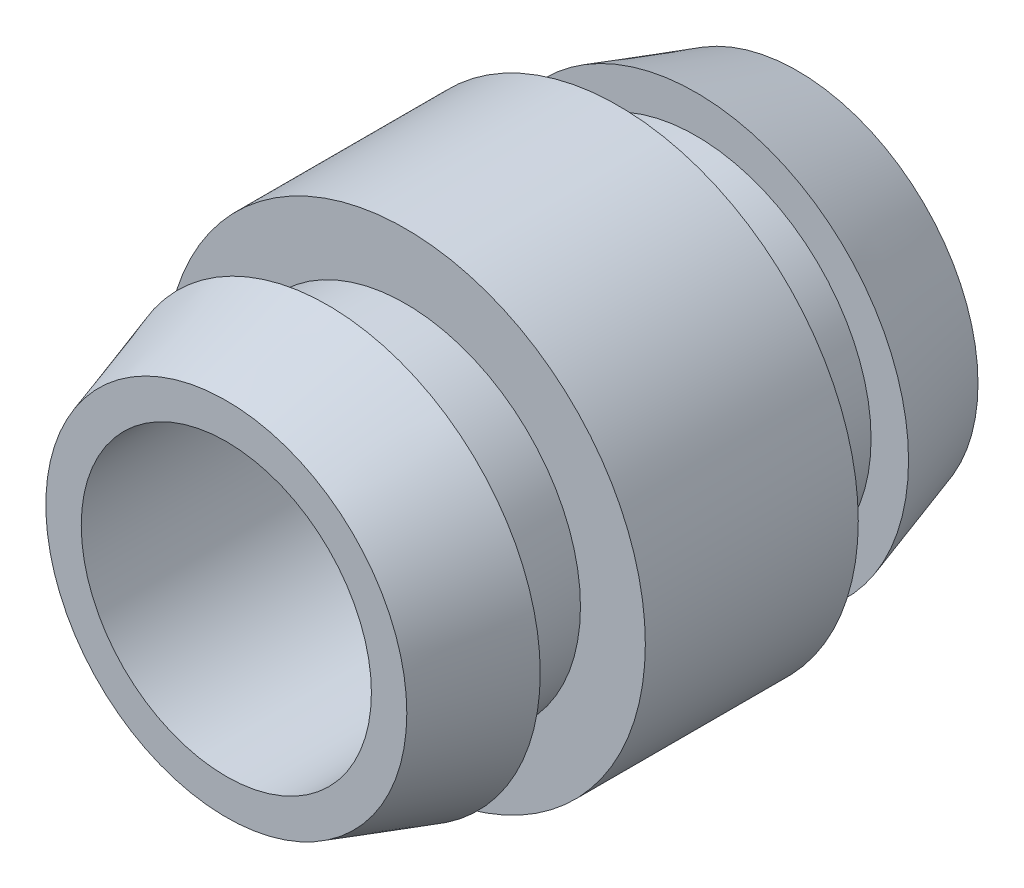
from build123d import *

# Parameters (mm, degrees)
SCALE1_SCALE = 0.6


with BuildPart() as part:
    # Sketch1 → Revolve1 (revolve)
    with BuildSketch(Plane(origin=(0, 0, 0), x_dir=(0, 0, -1), z_dir=(1, 0, 0)), mode=Mode.PRIVATE) as revolve1_sk:
        Polygon((0, -8.0645), (28.448, -8.0645), (28.448, 0), (31.75, 0), (31.75, -10.033), (26.1112, -11.811), (26.1112, -9.7282), (21.7932, -9.7282), (21.7932, -13.335), (9.9568, -13.335), (9.9568, -9.7282), (5.6388, -9.7282), (5.6388, -11.811), (0, -10.033), align=None)
    revolve(revolve1_sk.sketch.rotate(Axis((0, 0, 0), (0, 0, -1)), 270), axis=Axis((0, 0, 0), (0, 0, -1)))


with BuildPart() as part_1:
    # Scale1: scaled about (0, 0, -17.137127413)
    add(part.part.scale(SCALE1_SCALE).moved(Location((0, 0, -6.854850965))))


solid = part_1.part
